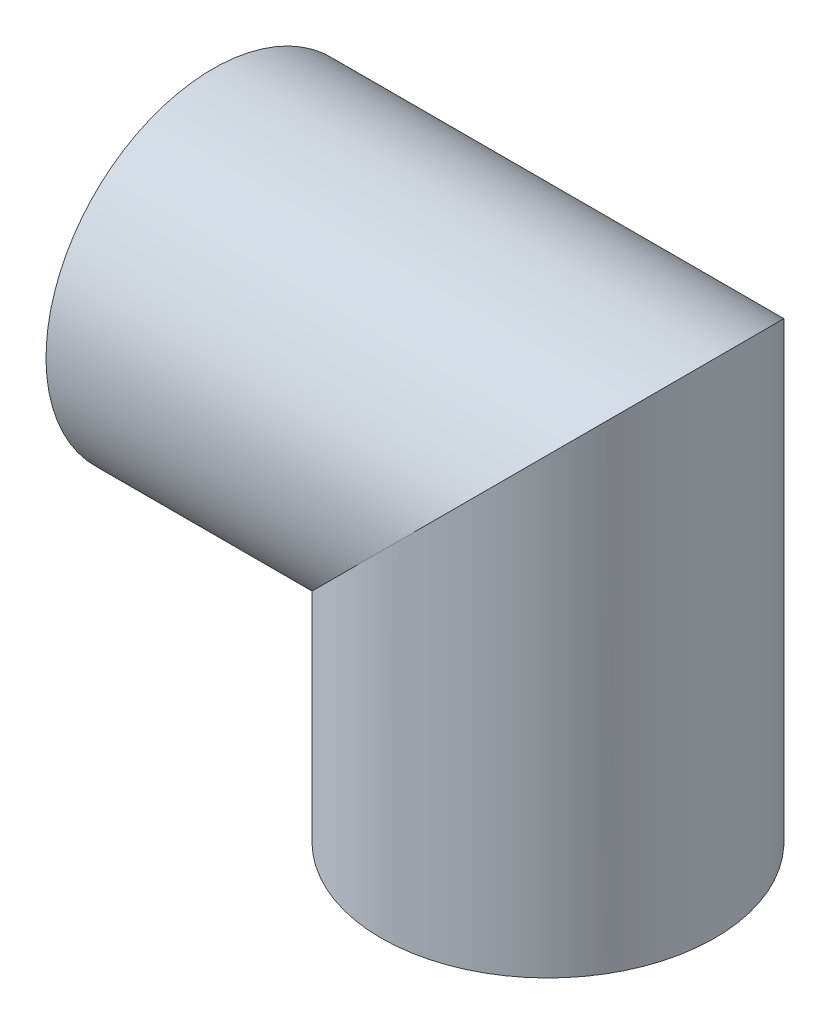
from build123d import *

# Parameters (mm, degrees)
BARRER_L_MINA1_PROFILE_R   = 12.65
BARRER_L_MINA1_PROFILE_R_2 = 10.65


with BuildPart() as part:
    # Barrer-Lámina1: sweep along a path in Croquis1
    with BuildLine(Plane.XY) as barrer_l_mina1_path:
        Line((-15.065742385, 0), (10.334257615, 0))
        Line((10.334257615, 0), (10.334257615, -25.4))
    # Barrer-Lámina1 profile (on start of the path) → Barrer-Lámina1 (sweep)
    with BuildSketch(Plane(origin=(-15.065742385, 0, 0), x_dir=(0, 0, 1), z_dir=(1, 0, 0))):
        Circle(BARRER_L_MINA1_PROFILE_R)
        Circle(BARRER_L_MINA1_PROFILE_R_2, mode=Mode.SUBTRACT)
    sweep(path=barrer_l_mina1_path.line, transition=Transition.RIGHT)


solid = part.part
